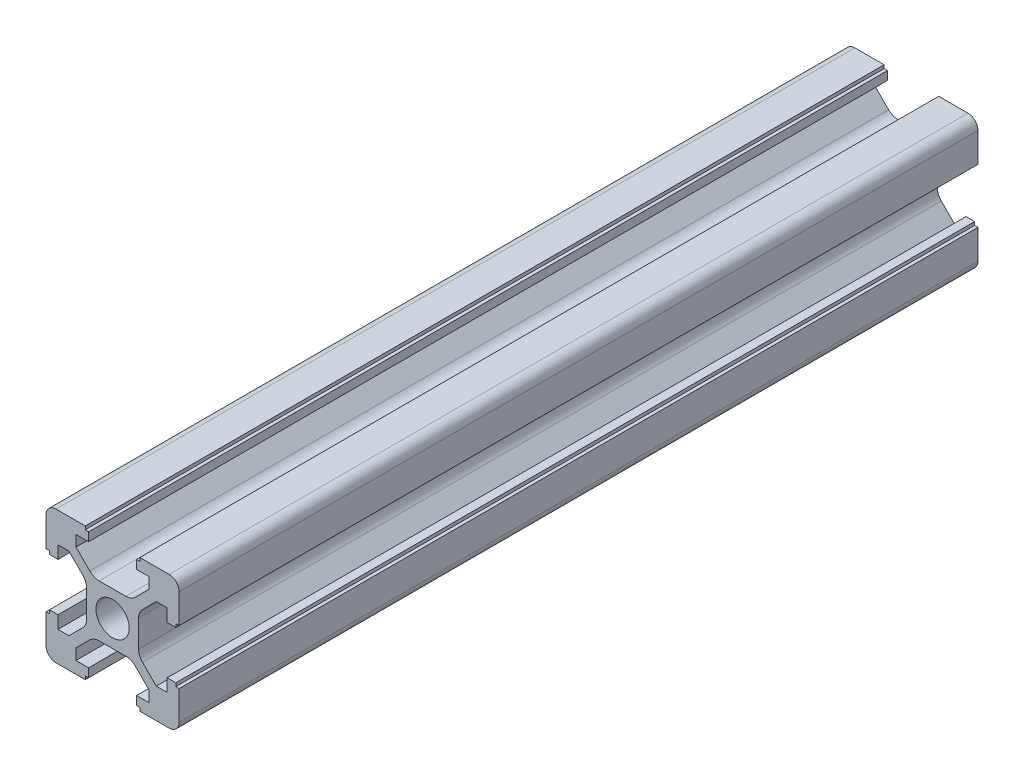
from build123d import *

# Parameters (mm, degrees)
SKETCH1_R           = 2.5
BOSS_EXTRUDE2_DEPTH = 120


with BuildPart() as part:
    # Sketch1 → Boss-Extrude2 (new body)
    with BuildSketch(Plane.XY):
        with BuildLine():
            Line((10, -4.1), (10, -8.5))
            ThreePointArc((10, -8.5), (9.560660172, -9.560660172), (8.5, -10))
            Line((8.5, -10), (4.1, -10))
            Line((4.1, -10), (4.1, -9.5))
            Line((4.1, -9.5), (3.6, -9.5))
            Line((3.6, -9.5), (3.6, -8.2))
            Line((3.6, -8.2), (5.5, -8.2))
            Line((5.5, -8.2), (5.5, -6.560660172))
            Line((5.5, -6.560660172), (3.425126266, -4.485786438))
            ThreePointArc((3.425126266, -4.485786438), (2.776279568, -4.052240935), (2.010912703, -3.9))
            Line((2.010912703, -3.9), (-2.010912703, -3.9))
            ThreePointArc((-2.010912703, -3.9), (-2.776279568, -4.052240935), (-3.425126266, -4.485786438))
            Line((-3.425126266, -4.485786438), (-5.5, -6.560660172))
            Line((-5.5, -6.560660172), (-5.5, -8.2))
            Line((-5.5, -8.2), (-3.6, -8.2))
            Line((-3.6, -8.2), (-3.6, -9.5))
            Line((-3.6, -9.5), (-4.1, -9.5))
            Line((-4.1, -9.5), (-4.1, -10))
            Line((-4.1, -10), (-8.5, -10))
            ThreePointArc((-8.5, -10), (-9.560660172, -9.560660172), (-10, -8.5))
            Line((-10, -8.5), (-10, -4.1))
            Line((-10, -4.1), (-9.5, -4.1))
            Line((-9.5, -4.1), (-9.5, -3.6))
            Line((-9.5, -3.6), (-8.2, -3.6))
            Line((-8.2, -3.6), (-8.2, -5.5))
            Line((-8.2, -5.5), (-6.560660172, -5.5))
            Line((-6.560660172, -5.5), (-4.485786438, -3.425126266))
            ThreePointArc((-4.485786438, -3.425126266), (-4.052240935, -2.776279568), (-3.9, -2.010912703))
            Line((-3.9, -2.010912703), (-3.9, 2.010912703))
            ThreePointArc((-3.9, 2.010912703), (-4.052240935, 2.776279568), (-4.485786438, 3.425126266))
            Line((-4.485786438, 3.425126266), (-6.560660172, 5.5))
            Line((-6.560660172, 5.5), (-8.2, 5.5))
            Line((-8.2, 5.5), (-8.2, 3.6))
            Line((-8.2, 3.6), (-9.5, 3.6))
            Line((-9.5, 3.6), (-9.5, 4.1))
            Line((-9.5, 4.1), (-10, 4.1))
            Line((-10, 4.1), (-10, 8.5))
            ThreePointArc((-10, 8.5), (-9.560660172, 9.560660172), (-8.5, 10))
            Line((-8.5, 10), (-4.1, 10))
            Line((-4.1, 10), (-4.1, 9.5))
            Line((-4.1, 9.5), (-3.6, 9.5))
            Line((-3.6, 9.5), (-3.6, 8.2))
            Line((-3.6, 8.2), (-5.5, 8.2))
            Line((-5.5, 8.2), (-5.5, 6.560660172))
            Line((-5.5, 6.560660172), (-3.425126266, 4.485786438))
            ThreePointArc((-3.425126266, 4.485786438), (-2.776279568, 4.052240935), (-2.010912703, 3.9))
            Line((-2.010912703, 3.9), (2.010912703, 3.9))
            ThreePointArc((2.010912703, 3.9), (2.776279568, 4.052240935), (3.425126266, 4.485786438))
            Line((3.425126266, 4.485786438), (5.5, 6.560660172))
            Line((5.5, 6.560660172), (5.5, 8.2))
            Line((5.5, 8.2), (3.6, 8.2))
            Line((3.6, 8.2), (3.6, 9.5))
            Line((3.6, 9.5), (4.1, 9.5))
            Line((4.1, 9.5), (4.1, 10))
            Line((4.1, 10), (8.5, 10))
            ThreePointArc((8.5, 10), (9.560660172, 9.560660172), (10, 8.5))
            Line((10, 8.5), (10, 4.1))
            Line((10, 4.1), (9.5, 4.1))
            Line((9.5, 4.1), (9.5, 3.6))
            Line((9.5, 3.6), (8.2, 3.6))
            Line((8.2, 3.6), (8.2, 5.5))
            Line((8.2, 5.5), (6.560660172, 5.5))
            Line((6.560660172, 5.5), (4.485786438, 3.425126266))
            ThreePointArc((4.485786438, 3.425126266), (4.052240935, 2.776279568), (3.9, 2.010912703))
            Line((3.9, 2.010912703), (3.9, -2.010912703))
            ThreePointArc((3.9, -2.010912703), (4.052240935, -2.776279568), (4.485786438, -3.425126266))
            Line((4.485786438, -3.425126266), (6.560660172, -5.5))
            Line((6.560660172, -5.5), (8.2, -5.5))
            Line((8.2, -5.5), (8.2, -3.6))
            Line((8.2, -3.6), (9.5, -3.6))
            Line((9.5, -3.6), (9.5, -4.1))
            Line((9.5, -4.1), (10, -4.1))
        make_face()
        Circle(SKETCH1_R, mode=Mode.SUBTRACT)
    extrude(amount=BOSS_EXTRUDE2_DEPTH)


solid = part.part
